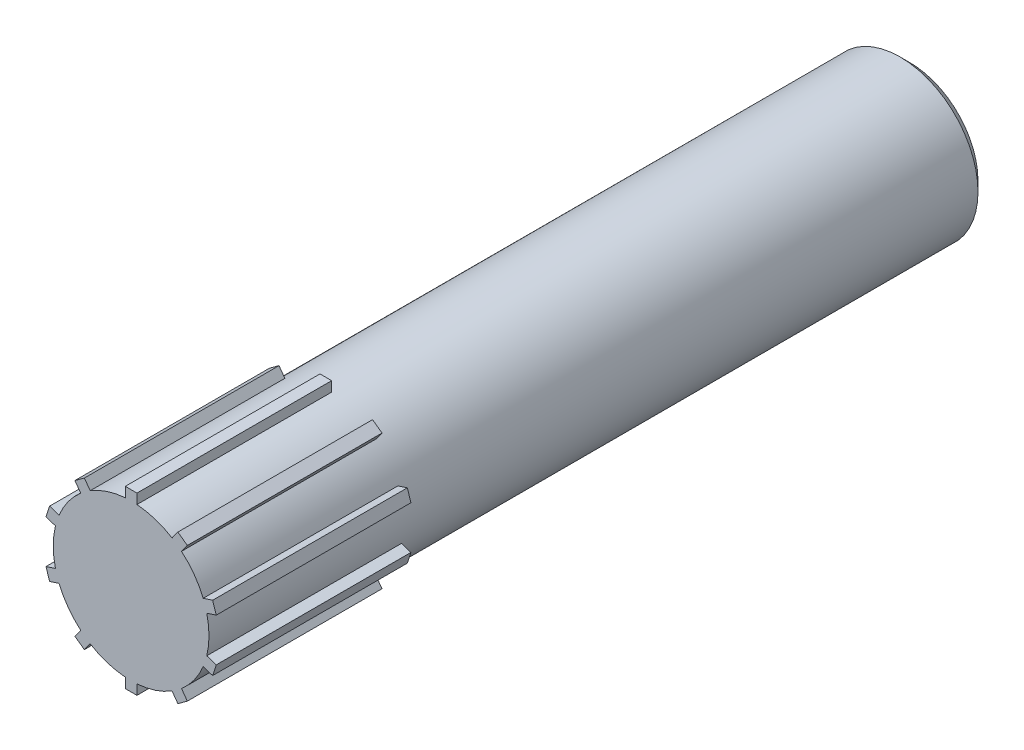
from build123d import *

# Parameters (mm, degrees)
SKETCH1_R           = 4
BOSS_EXTRUDE1_DEPTH = 40
CUT_EXTRUDE1_START  = -2.5
CUT_EXTRUDE1_DEPTH  = 38.898019753
SKETCH3_W           = 0.6
SKETCH3_H           = 1.896731377
BOSS_EXTRUDE2_DEPTH = 10
CIRPATTERN1_COUNT   = 10
CHAMFER1_SIZE       = 0.5


with BuildPart() as part:
    # Sketch1 → Boss-Extrude1 (new body)
    with BuildSketch(Plane.XY):
        Circle(SKETCH1_R)
    extrude(amount=BOSS_EXTRUDE1_DEPTH)

    # Sketch2 → Cut-Extrude1 (cut, through all)
    with BuildSketch(Plane(origin=(0, 0, 0), x_dir=(1, 0, 0), z_dir=(0, 1, 0)).offset(CUT_EXTRUDE1_START)):
        with BuildLine():
            Line((1.5, -5), (1.5, -9))
            ThreePointArc((1.5, -9), (0, -10.5), (-1.5, -9))
            Line((-1.5, -9), (-1.5, -5))
            ThreePointArc((-1.5, -5), (0, -3.5), (1.5, -5))
        make_face()
    extrude(amount=-CUT_EXTRUDE1_DEPTH, mode=Mode.SUBTRACT)

    # Sketch3 → Boss-Extrude2 (add)
    with BuildSketch(Plane.XY.offset(40)):
        with Locations((0, 3.551634311)):
            Rectangle(SKETCH3_W, SKETCH3_H)
    boss_extrude2 = extrude(amount=-BOSS_EXTRUDE2_DEPTH)

    # CirPattern1: Boss-Extrude2 ×10 about axis
    cirpattern1_axis = Axis((0, 0, 0), (0, 0, 1))
    for i in range(1, CIRPATTERN1_COUNT):
        add(boss_extrude2.rotate(cirpattern1_axis, i * 360 / CIRPATTERN1_COUNT))

    # Chamfer1
    chamfer1_edges = [part.edges().sort_by_distance(p)[0] for p in [
        (-4, 0, 0),
    ]]
    chamfer(chamfer1_edges, length=CHAMFER1_SIZE)


solid = part.part
